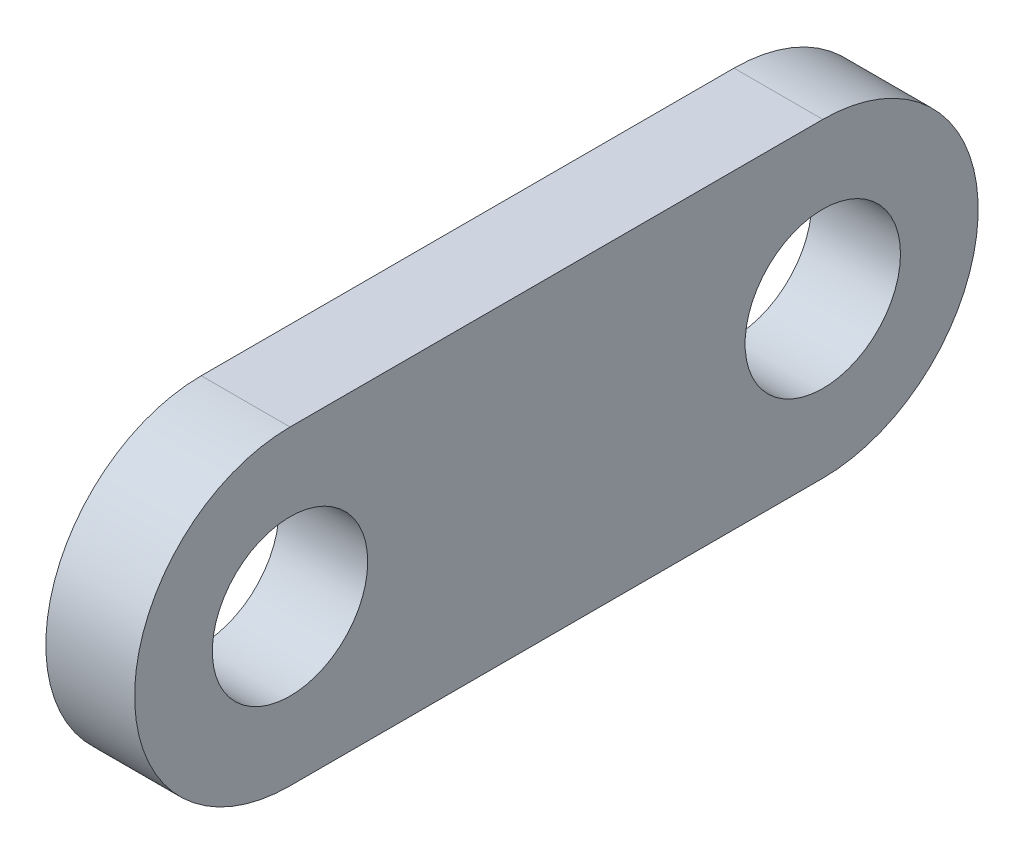
from build123d import *

# Parameters (mm, degrees)
SKETCH1_R           = 1.75
BOSS_EXTRUDE1_DEPTH = 2


with BuildPart() as part:
    # Sketch1 → Boss-Extrude1 (new body)
    with BuildSketch(Plane(origin=(0, 0, 0), x_dir=(0, 0, -1), z_dir=(1, 0, 0))):
        with BuildLine():
            Line((-6, 4.273345061), (6, 4.273345061))
            ThreePointArc((6, 4.273345061), (9.5, 0.773345061), (6, -2.726654939))
            Line((6, -2.726654939), (-6, -2.726654939))
            ThreePointArc((-6, -2.726654939), (-9.5, 0.773345061), (-6, 4.273345061))
        make_face()
        with Locations((-6, 0.773345061)):
            Circle(SKETCH1_R, mode=Mode.SUBTRACT)
        with Locations((6, 0.773345061)):
            Circle(SKETCH1_R, mode=Mode.SUBTRACT)
    extrude(amount=BOSS_EXTRUDE1_DEPTH)


solid = part.part
